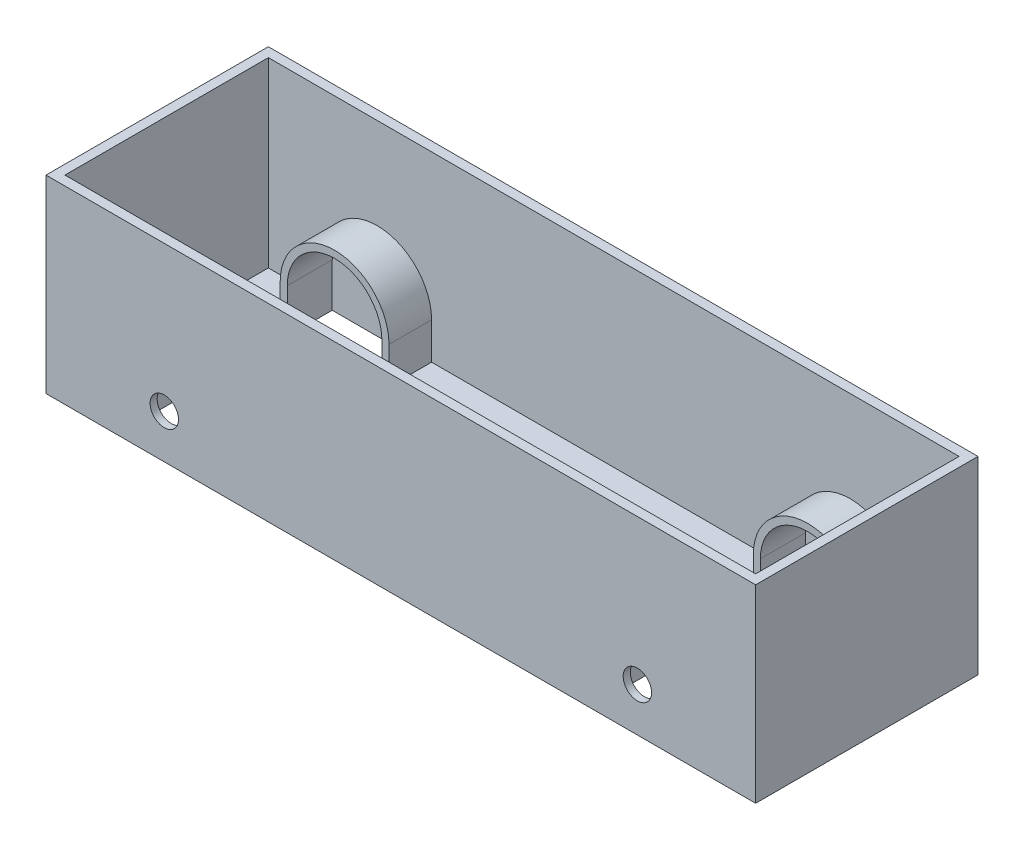
from build123d import *

# Parameters (mm, degrees)
SALIENTE_EXTRUIR1_DEPTH    = 47
CROQUIS2_W                 = 50
CROQUIS2_H                 = 38.5
CORTAR_EXTRUIR1_DEPTH      = 281.107568623
SALIENTE_EXTRUIR2_DEPTH    = 3
SALIENTE_EXTRUIR3_DEPTH    = 4
SALIENTE_EXTRUIR4_START    = -4
SALIENTE_EXTRUIR4_DEPTH    = 4
CROQUIS6_W                 = 86
CROQUIS6_H                 = 77
SALIENTE_EXTRUIR5_DEPTH    = 4
CROQUIS7_W                 = 86
CROQUIS7_H                 = 77
SALIENTE_EXTRUIR6_DEPTH    = 4
CORTAR_EXTRUIR2_DEPTH      = 193.353840617
CORTAR_EXTRUIR2_DEPTH_BACK = 193.353840617
CROQUIS9_R                 = 6


with BuildPart() as part:
    # Croquis1 → Saliente-Extruir1 (new, symmetric)
    with BuildSketch(Plane.XY):
        with BuildLine():
            Line((-150, 0), (-120, 0))
            Line((-120, 0), (-120, 18.5))
            ThreePointArc((-120, 18.5), (-100, 38.5), (-80, 18.5))
            Line((-80, 18.5), (-80, 0))
            Line((-80, 0), (80, 0))
            Line((80, 0), (80, 18.5))
            ThreePointArc((80, 18.5), (100, 38.5), (120, 18.5))
            Line((120, 18.5), (120, 0))
            Line((120, 0), (150, 0))
            Line((150, 0), (150, 3))
            Line((150, 3), (123, 3))
            Line((123, 3), (123, 18.5))
            ThreePointArc((123, 18.5), (100, 41.5), (77, 18.5))
            Line((77, 18.5), (77, 3))
            Line((77, 3), (-77, 3))
            Line((-77, 3), (-77, 18.5))
            ThreePointArc((-77, 18.5), (-100, 41.5), (-123, 18.5))
            Line((-123, 18.5), (-123, 3))
            Line((-123, 3), (-150, 3))
            Line((-150, 3), (-150, 0))
        make_face()
    extrude(amount=SALIENTE_EXTRUIR1_DEPTH, both=True)

    # Croquis2 → Cortar-Extruir1 (cut, through all)
    with BuildSketch(Plane(origin=(123, 0, 0), x_dir=(0, 0, -1), z_dir=(1, 0, 0))):
        with Locations((0, 22.25)):
            Rectangle(CROQUIS2_W, CROQUIS2_H)
    extrude(amount=-CORTAR_EXTRUIR1_DEPTH, mode=Mode.SUBTRACT)

    # Croquis3 → Saliente-Extruir2 (add)
    with BuildSketch(Plane.XY.offset(47)):
        with BuildLine():
            Line((120, 18.5), (120, 0))
            Line((120, 0), (80, 0))
            Line((80, 0), (80, 18.5))
            ThreePointArc((80, 18.5), (100, 38.5), (120, 18.5))
        make_face()
        with BuildLine():
            Line((-120, 0), (-120, 18.5))
            ThreePointArc((-120, 18.5), (-100, 38.5), (-80, 18.5))
            Line((-80, 18.5), (-80, 0))
            Line((-80, 0), (-120, 0))
        make_face()
    saliente_extruir2 = extrude(amount=-SALIENTE_EXTRUIR2_DEPTH)

    # Simetría1: Saliente-Extruir2 across plane
    add(saliente_extruir2.mirror(Plane.XY))

    # Croquis4 → Saliente-Extruir3 (add)
    with BuildSketch(Plane.XY.offset(47)):
        with BuildLine():
            Line((150, 80), (-150, 80))
            Line((-150, 80), (-150, 3))
            Line((-150, 3), (-123, 3))
            Line((-123, 3), (-123, 18.5))
            ThreePointArc((-123, 18.5), (-100, 41.5), (-77, 18.5))
            Line((-77, 18.5), (-77, 3))
            Line((-77, 3), (77, 3))
            Line((77, 3), (77, 18.5))
            ThreePointArc((77, 18.5), (100, 41.5), (123, 18.5))
            Line((123, 18.5), (123, 3))
            Line((123, 3), (150, 3))
            Line((150, 3), (150, 80))
        make_face()
    extrude(amount=-SALIENTE_EXTRUIR3_DEPTH)

    # Croquis5 → Saliente-Extruir4 (add)
    with BuildSketch(Plane(origin=(0, 0, -47), x_dir=(-1, 0, 0), z_dir=(0, 0, -1)).offset(SALIENTE_EXTRUIR4_START)):
        with BuildLine():
            Line((123, 3), (150, 3))
            Line((150, 3), (150, 80))
            Line((150, 80), (-150, 80))
            Line((-150, 80), (-150, 3))
            Line((-150, 3), (-123, 3))
            Line((-123, 3), (-123, 18.5))
            ThreePointArc((-123, 18.5), (-100, 41.5), (-77, 18.5))
            Line((-77, 18.5), (-77, 3))
            Line((-77, 3), (77, 3))
            Line((77, 3), (77, 18.5))
            ThreePointArc((77, 18.5), (100, 41.5), (123, 18.5))
            Line((123, 18.5), (123, 3))
        make_face()
    extrude(amount=SALIENTE_EXTRUIR4_DEPTH)

    # Croquis6 → Saliente-Extruir5 (add)
    with BuildSketch(Plane(origin=(150, 0, 0), x_dir=(0, 0, -1), z_dir=(1, 0, 0))):
        with Locations((0, 41.5)):
            Rectangle(CROQUIS6_W, CROQUIS6_H)
    extrude(amount=-SALIENTE_EXTRUIR5_DEPTH)

    # Croquis7 → Saliente-Extruir6 (add)
    with BuildSketch(Plane.ZY.offset(150)):
        with Locations((0, 41.5)):
            Rectangle(CROQUIS7_W, CROQUIS7_H)
    extrude(amount=-SALIENTE_EXTRUIR6_DEPTH)

    # Croquis9 → Cortar-Extruir2 (cut, two sides: drawn at the far end of the back side and taken through both)
    with BuildSketch(Plane(origin=(0, 0, 43), x_dir=(-1, 0, 0), z_dir=(0, 0, -1)).offset(-CORTAR_EXTRUIR2_DEPTH_BACK)):
        with Locations((100, 18.5)):
            Circle(CROQUIS9_R)
        with Locations((-100, 18.5)):
            Circle(CROQUIS9_R)
    extrude(amount=CORTAR_EXTRUIR2_DEPTH + CORTAR_EXTRUIR2_DEPTH_BACK, mode=Mode.SUBTRACT)


solid = part.part
